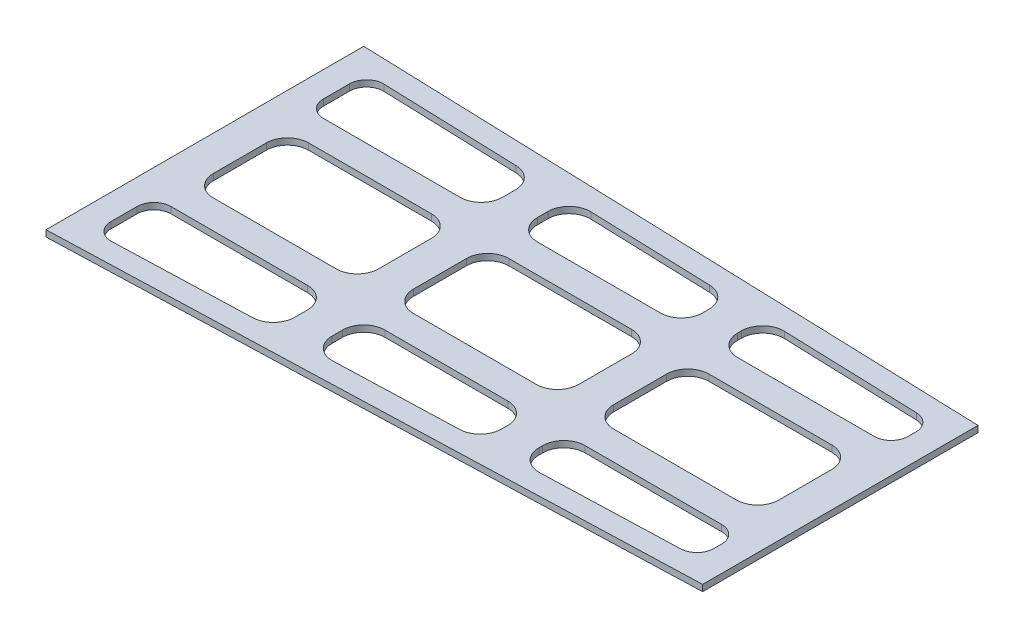
from build123d import *

# Parameters (mm, degrees)
BOSS_EXTRUDE1_DEPTH = 3
SKETCH2_W           = 78
SKETCH2_H           = 45
CUT_EXTRUDE1_DEPTH  = 10
FILLET1_R           = 10
CUT_EXTRUDE2_DEPTH  = 10
SKETCH4_W           = 16.5
SKETCH4_H           = 134.835477832
SKETCH4_H_2         = 126.10677569
BOSS_EXTRUDE2_DEPTH = 3
FILLET2_R           = 10
FILLET3_R           = 10


with BuildPart() as part:
    # Sketch1 → Boss-Extrude1 (new body)
    with BuildSketch(Plane(origin=(0, 0, 0), x_dir=(1, 0, 0), z_dir=(0, 1, 0))):
        Polygon((0, 0), (0, 75.000000004), (300, 65), (300, 0), align=None)
    boss_extrude1 = extrude(amount=BOSS_EXTRUDE1_DEPTH)

    # Mirror1: Boss-Extrude1 across Front Plane
    add(boss_extrude1.mirror(Plane.XY))

    # Sketch2 → Cut-Extrude1 (cut)
    with BuildSketch(Plane(origin=(0, 3, 0), x_dir=(1, 0, 0), z_dir=(0, 1, 0))):
        with Locations((55.5, 0)):
            Rectangle(SKETCH2_W, SKETCH2_H)
        with Locations((150, 0)):
            Rectangle(SKETCH2_W, SKETCH2_H)
        with Locations((244.5, 0)):
            Rectangle(SKETCH2_W, SKETCH2_H)
    extrude(amount=-CUT_EXTRUDE1_DEPTH, mode=Mode.SUBTRACT)

    # Fillet1
    fillet1_edges = [part.edges().sort_by_distance(p)[0] for p in [
        (16.5, 1.5, 22.5),
        (16.5, 1.5, -22.5),
        (94.5, 1.5, -22.5),
        (94.5, 1.5, 22.5),
        (111, 1.5, 22.5),
        (111, 1.5, -22.5),
        (189, 1.5, -22.5),
        (189, 1.5, 22.5),
        (205.5, 1.5, 22.5),
        (205.5, 1.5, -22.5),
        (283.5, 1.5, -22.5),
        (283.5, 1.5, 22.5),
    ]]
    fillet(fillet1_edges, radius=FILLET1_R)

    # Sketch3 → Cut-Extrude2 (cut)
    with BuildSketch(Plane(origin=(0, 3, 0), x_dir=(1, 0, 0), z_dir=(0, 1, 0))):
        with BuildLine():
            Line((12, 56.323336113), (12, 44))
            ThreePointArc((12, 44), (14.343145751, 38.343145751), (20, 36))
            Line((20, 36), (280, 36))
            ThreePointArc((280, 36), (285.656854249, 38.343145751), (288, 44))
            Line((288, 44), (288, 47.656669443))
            ThreePointArc((288, 47.656669443), (285.750310824, 53.218496969), (280.266518642, 55.652228699))
            Line((280.266518642, 55.652228699), (20.266518642, 64.318895369))
            ThreePointArc((20.266518642, 64.318895369), (14.438172474, 62.073646937), (12, 56.323336113))
        make_face()
    cut_extrude2 = extrude(amount=-CUT_EXTRUDE2_DEPTH, mode=Mode.SUBTRACT)

    # Mirror2: Cut-Extrude2 across plane
    add(cut_extrude2.mirror(Plane.XY), mode=Mode.SUBTRACT)

    # Sketch4 → Boss-Extrude2 (add)
    with BuildSketch(Plane(origin=(0, 3, 0), x_dir=(1, 0, 0), z_dir=(0, 1, 0))):
        with Locations((102.75, 0)):
            Rectangle(SKETCH4_W, SKETCH4_H)
        with Locations((197.25, 0)):
            Rectangle(SKETCH4_W, SKETCH4_H_2)
    extrude(amount=-BOSS_EXTRUDE2_DEPTH)

    # Fillet2
    fillet2_edges = [part.edges().sort_by_distance(p)[0] for p in [
        (111, 1.5, -36),
        (111, 1.5, -61.294445989),
        (94.5, 1.5, -36),
        (94.5, 1.5, -61.844445989),
        (189, 1.5, -36),
        (205.5, 1.5, -36),
        (205.5, 1.5, -58.144445988),
        (189, 1.5, -58.694445988),
    ]]
    fillet(fillet2_edges, radius=FILLET2_R)

    # Fillet3
    fillet3_edges = [part.edges().sort_by_distance(p)[0] for p in [
        (94.5, 1.5, 36),
        (111, 1.5, 36),
        (111, 1.5, 61.294445989),
        (94.5, 1.5, 61.844445989),
        (189, 1.5, 58.694445988),
        (189, 1.5, 36),
        (205.5, 1.5, 58.144445988),
        (205.5, 1.5, 36),
    ]]
    fillet(fillet3_edges, radius=FILLET3_R)


solid = part.part
